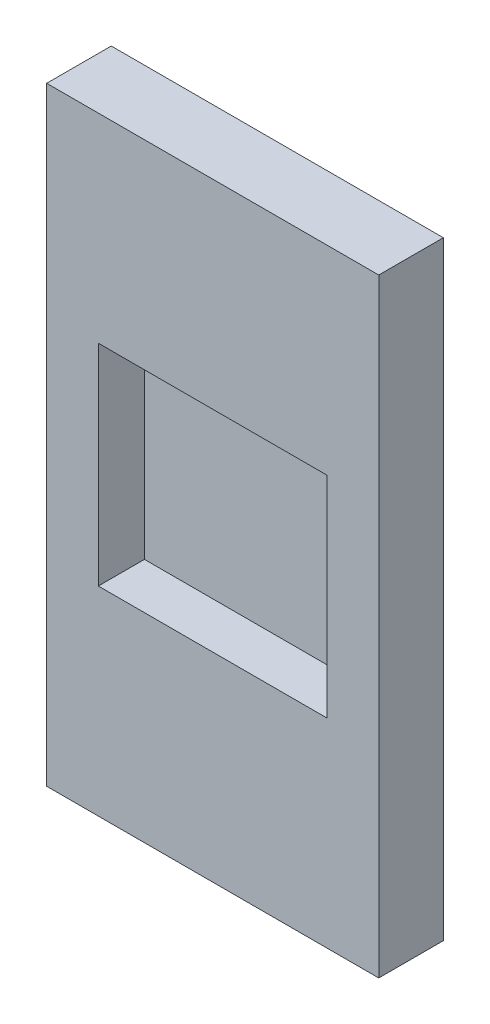
from build123d import *

# Parameters (mm, degrees)
SKETCH_1_W          = 18
SKETCH_1_H          = 33
EXTRUDE_1_DEPTH     = 3.5
SKETCH_2_W          = 12.4
SKETCH_2_H          = 11.4
CUT_EXTRUDE_1_DEPTH = 2.5


with BuildPart() as part:
    # 스케치1 → 보스-돌출1 (new body)
    with BuildSketch(Plane.XY):
        Rectangle(SKETCH_1_W, SKETCH_1_H)
    extrude(amount=EXTRUDE_1_DEPTH)

    # 스케치2 → 컷-돌출1 (cut)
    with BuildSketch(Plane.XY.offset(3.5)):
        Rectangle(SKETCH_2_W, SKETCH_2_H)
    extrude(amount=-CUT_EXTRUDE_1_DEPTH, mode=Mode.SUBTRACT)


solid = part.part
